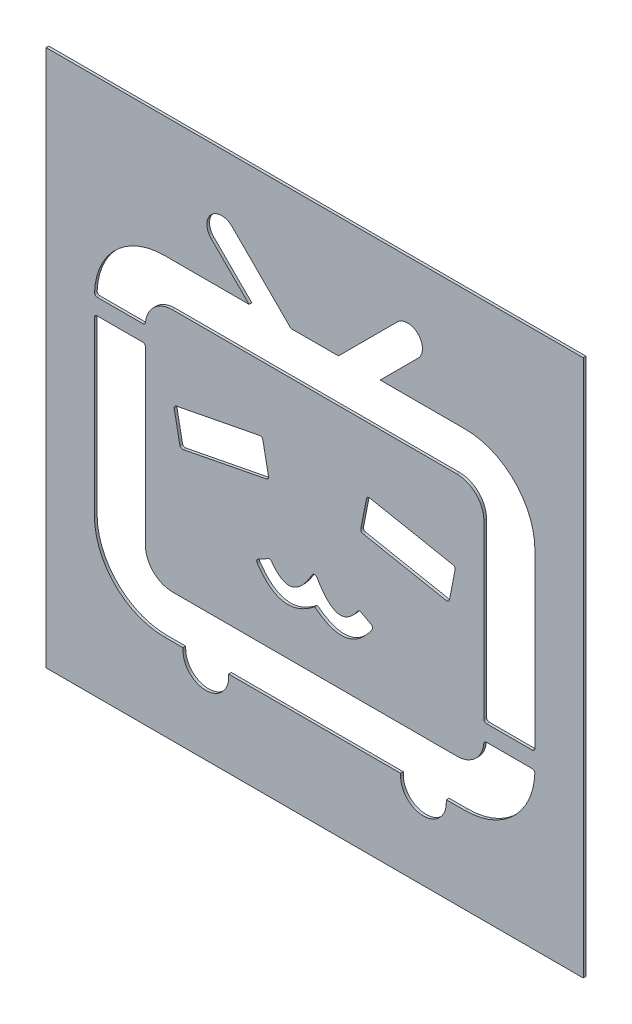
from build123d import *

# Parameters (mm, degrees)
SKETCH_1_W       = 200
SKETCH_1_H       = 200
BACKGROUND_DEPTH = 1
LOGO_DEPTH       = 10
FILLET_R_R       = 1


with BuildPart() as part:
    # 草图1 → Background (new body)
    with BuildSketch(Plane.XY):
        with Locations((100, -100)):
            Rectangle(SKETCH_1_W, SKETCH_1_H)
    extrude(amount=BACKGROUND_DEPTH)

    # 草图2 → Logo (cut)
    with BuildSketch(Plane.XY.offset(1)):
        with BuildLine():
            Line((44, -45), (75.594408409, -45))
            Line((75.594408409, -45), (61.483495706, -30.889087297))
            ThreePointArc((61.483495706, -30.889087297), (61.483495706, -23.110912703), (69.261670299, -23.110912703))
            Line((69.261670299, -23.110912703), (91.150757595, -45))
            Line((91.150757595, -45), (108.849242405, -45))
            Line((108.849242405, -45), (130.738329701, -23.110912703))
            ThreePointArc((130.738329701, -23.110912703), (138.516504294, -23.110912703), (138.516504294, -30.889087297))
            Line((138.516504294, -30.889087297), (124.405591591, -45))
            Line((124.405591591, -45), (156, -45))
            ThreePointArc((156, -45), (174.384776311, -52.615223689), (182, -71))
            Line((182, -71), (182, -136))
            Line((182, -136), (163, -136))
            Line((163, -136), (163, -71))
            ThreePointArc((163, -71), (160.071067812, -63.928932188), (153, -61))
            Line((153, -61), (47, -61))
            ThreePointArc((47, -61), (39.928932188, -63.928932188), (37, -71))
            Line((37, -71), (18, -71))
            ThreePointArc((18, -71), (25.615223689, -52.615223689), (44, -45))
        make_face()
        with BuildLine():
            Line((44, -168), (51, -168))
            Line((51, -168), (51, -169))
            ThreePointArc((51, -169), (59.5, -177.5), (68, -169))
            Line((68, -169), (68, -168))
            Line((68, -168), (132, -168))
            Line((132, -168), (132, -169))
            ThreePointArc((132, -169), (140.5, -177.5), (149, -169))
            Line((149, -169), (149, -168))
            Line((149, -168), (156, -168))
            ThreePointArc((156, -168), (174.384776311, -160.384776311), (182, -142))
            Line((182, -142), (163, -142))
            ThreePointArc((163, -142), (160.071067812, -149.071067812), (153, -152))
            Line((153, -152), (47, -152))
            ThreePointArc((47, -152), (39.928932188, -149.071067812), (37, -142))
            Line((37, -142), (37, -77))
            Line((37, -77), (18, -77))
            Line((18, -77), (18, -142))
            ThreePointArc((18, -142), (25.615223689, -160.384776311), (44, -168))
        make_face()
        Polygon((47.51948306, -91.53578191), (80.51948306, -85.121231708), (83, -97.882385093), (50, -104.296935295), align=None)
        Polygon((119.48051694, -84.796316416), (152.48051694, -91.210866617), (150, -103.972020002), (117, -97.557469801), align=None)
        with BuildLine():
            Line((78, -126), (83.5, -123))
            add(Edge.make_bspline(
                [(83.5, -123), (91.450014857, -135.202864972), (100, -118.812493298)],
                knots=[0, 0, 0, 1, 1, 1], degree=2))
            add(Edge.make_bspline(
                [(116.5, -123), (108.549985143, -135.202864972), (100, -118.812493298)],
                knots=[0, 0, 0, 1, 1, 1], degree=2))
            Line((116.5, -123), (122, -126))
            add(Edge.make_bspline(
                [(122, -126), (112.840164848, -140.569491763), (100, -130.315373567)],
                knots=[0, 0, 0, 1, 1, 1], degree=2))
            add(Edge.make_bspline(
                [(78, -126), (87.159835152, -140.569491763), (100, -130.315373567)],
                knots=[0, 0, 0, 1, 1, 1], degree=2))
        make_face()
    extrude(amount=-LOGO_DEPTH, mode=Mode.SUBTRACT)

    # R
    fillet_r_edges = [part.edges().sort_by_distance(p)[0] for p in [
        (122, -126, 0.5),
        (116.5, -123, 0.5),
        (100, -118.812493298, 0.5),
        (78, -126, 0.5),
        (83.5, -123, 0.5),
        (117, -97.557469801, 0.5),
        (150, -103.972020002, 0.5),
        (152.48051694, -91.210866617, 0.5),
        (119.48051694, -84.796316416, 0.5),
        (50, -104.296935295, 0.5),
        (83, -97.882385093, 0.5),
        (80.51948306, -85.121231708, 0.5),
        (47.51948306, -91.53578191, 0.5),
        (163, -142, 0.5),
        (182, -142, 0.5),
        (182, -136, 0.5),
        (163, -136, 0.5),
        (18, -71, 0.5),
        (37, -71, 0.5),
        (37, -77, 0.5),
        (18, -77, 0.5),
    ]]
    fillet(fillet_r_edges, radius=FILLET_R_R)


solid = part.part
